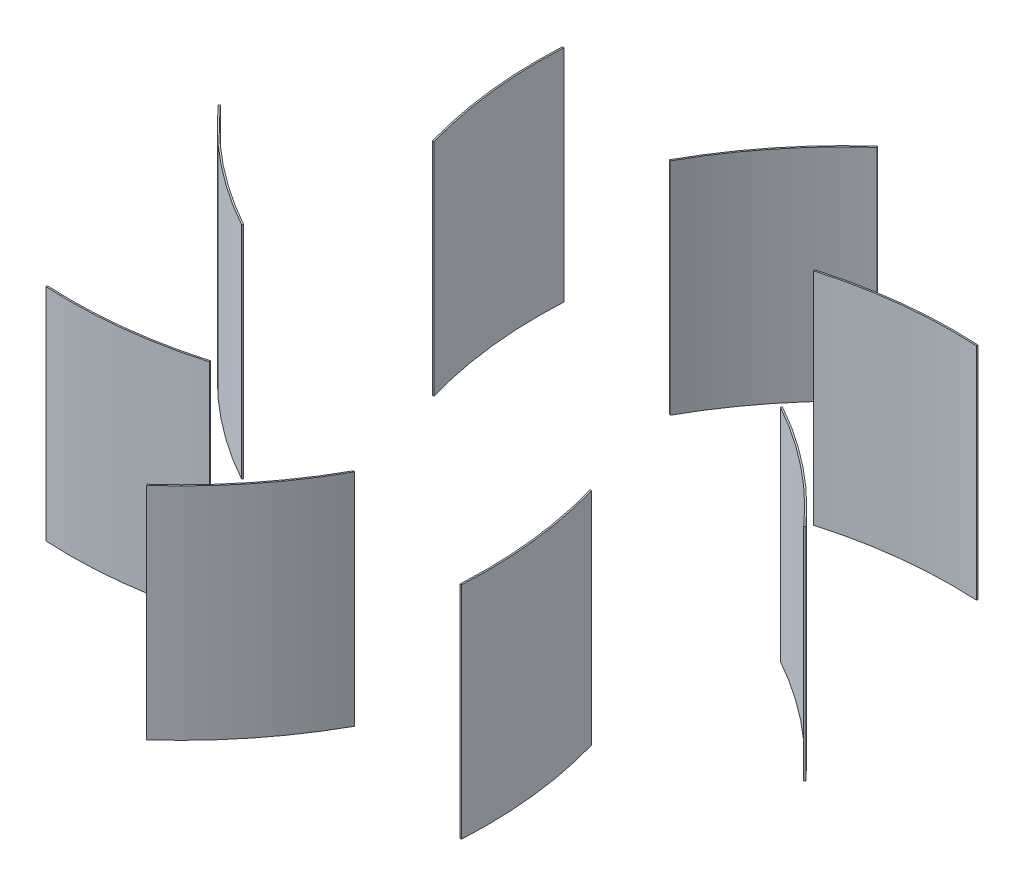
from build123d import *

# Parameters (mm, degrees)
EXTRUDE_THIN3_DEPTH   = 300
EXTRUDE_THIN3_2_DEPTH = 300
EXTRUDE_THIN3_3_DEPTH = 300
EXTRUDE_THIN3_4_DEPTH = 300
EXTRUDE_THIN3_5_DEPTH = 300
EXTRUDE_THIN3_6_DEPTH = 300
EXTRUDE_THIN3_7_DEPTH = 300
EXTRUDE_THIN3_8_DEPTH = 300


with BuildPart() as part:
    # Sketch1 → Extrude-Thin3 (new body)
    with BuildSketch(Plane(origin=(0, 1200, 0), x_dir=(1, 0, 0), z_dir=(0, 1, 0))):
        with BuildLine():
            ThreePointArc((50, 447.2135955), (-19.09284232, 374.101463889), (-75, 290.473750966))
            Line((-75, 290.473750966), (-76.75, 291.441996802))
            ThreePointArc((-76.75, 291.441996802), (-20.656485128, 375.348468769), (48.666666667, 448.704307485))
            Line((48.666666667, 448.704307485), (50, 447.2135955))
        make_face()
    extrude(amount=EXTRUDE_THIN3_DEPTH)


with BuildPart() as body_2:
    # Sketch1 → Extrude-Thin3 2 (new body)
    with BuildSketch(Plane(origin=(0, 1200, 0), x_dir=(1, 0, 0), z_dir=(0, 1, 0))):
        with BuildLine():
            ThreePointArc((351.583105076, 280.872426957), (251.029003691, 278.030360244), (152.362950476, 258.428967653))
            Line((152.362950476, 258.428967653), (151.810166805, 260.351057717))
            ThreePointArc((151.810166805, 260.351057717), (250.805106865, 280.017788284), (351.694388588, 282.869328552))
            Line((351.694388588, 282.869328552), (351.583105076, 280.872426957))
        make_face()
    extrude(amount=EXTRUDE_THIN3_2_DEPTH)


with BuildPart() as body_3:
    # Sketch1 → Extrude-Thin3 3 (new body)
    with BuildSketch(Plane(origin=(0, 1200, 0), x_dir=(1, 0, 0), z_dir=(0, 1, 0))):
        with BuildLine():
            ThreePointArc((447.2135955, -50), (374.101463889, 19.09284232), (290.473750966, 75))
            Line((290.473750966, 75), (291.441996802, 76.75))
            ThreePointArc((291.441996802, 76.75), (375.348468769, 20.656485128), (448.704307485, -48.666666667))
            Line((448.704307485, -48.666666667), (447.2135955, -50))
        make_face()
    extrude(amount=EXTRUDE_THIN3_3_DEPTH)


with BuildPart() as body_4:
    # Sketch1 → Extrude-Thin3 4 (new body)
    with BuildSketch(Plane(origin=(0, 1200, 0), x_dir=(1, 0, 0), z_dir=(0, 1, 0))):
        with BuildLine():
            ThreePointArc((280.872426958, -351.583105076), (278.030360245, -251.029003691), (258.428967653, -152.362950475))
            Line((258.428967653, -152.362950475), (260.351057717, -151.810166805))
            ThreePointArc((260.351057717, -151.810166805), (280.017788284, -250.805106865), (282.869328553, -351.694388588))
            Line((282.869328553, -351.694388588), (280.872426958, -351.583105076))
        make_face()
    extrude(amount=EXTRUDE_THIN3_4_DEPTH)


with BuildPart() as body_5:
    # Sketch1 → Extrude-Thin3 5 (new body)
    with BuildSketch(Plane(origin=(0, 1200, 0), x_dir=(1, 0, 0), z_dir=(0, 1, 0))):
        with BuildLine():
            ThreePointArc((-50, -447.2135955), (19.09284232, -374.101463889), (75, -290.473750966))
            Line((75, -290.473750966), (76.75, -291.441996802))
            ThreePointArc((76.75, -291.441996802), (20.656485128, -375.348468769), (-48.666666667, -448.704307485))
            Line((-48.666666667, -448.704307485), (-50, -447.2135955))
        make_face()
    extrude(amount=EXTRUDE_THIN3_5_DEPTH)


with BuildPart() as body_6:
    # Sketch1 → Extrude-Thin3 6 (new body)
    with BuildSketch(Plane(origin=(0, 1200, 0), x_dir=(1, 0, 0), z_dir=(0, 1, 0))):
        with BuildLine():
            ThreePointArc((-351.583105076, -280.872426958), (-251.029003691, -278.030360245), (-152.362950475, -258.428967653))
            Line((-152.362950475, -258.428967653), (-151.810166805, -260.351057717))
            ThreePointArc((-151.810166805, -260.351057717), (-250.805106865, -280.017788284), (-351.694388588, -282.869328552))
            Line((-351.694388588, -282.869328552), (-351.583105076, -280.872426958))
        make_face()
    extrude(amount=EXTRUDE_THIN3_6_DEPTH)


with BuildPart() as body_7:
    # Sketch1 → Extrude-Thin3 7 (new body)
    with BuildSketch(Plane(origin=(0, 1200, 0), x_dir=(1, 0, 0), z_dir=(0, 1, 0))):
        with BuildLine():
            ThreePointArc((-447.2135955, 50), (-374.101463889, -19.09284232), (-290.473750966, -75))
            Line((-290.473750966, -75), (-291.441996802, -76.75))
            ThreePointArc((-291.441996802, -76.75), (-375.348468769, -20.656485128), (-448.704307485, 48.666666667))
            Line((-448.704307485, 48.666666667), (-447.2135955, 50))
        make_face()
    extrude(amount=EXTRUDE_THIN3_7_DEPTH)


with BuildPart() as body_8:
    # Sketch1 → Extrude-Thin3 8 (new body)
    with BuildSketch(Plane(origin=(0, 1200, 0), x_dir=(1, 0, 0), z_dir=(0, 1, 0))):
        with BuildLine():
            ThreePointArc((-280.872426958, 351.583105076), (-278.030360245, 251.029003691), (-258.428967653, 152.362950475))
            Line((-258.428967653, 152.362950475), (-260.351057717, 151.810166805))
            ThreePointArc((-260.351057717, 151.810166805), (-280.017788284, 250.805106865), (-282.869328553, 351.694388588))
            Line((-282.869328553, 351.694388588), (-280.872426958, 351.583105076))
        make_face()
    extrude(amount=EXTRUDE_THIN3_8_DEPTH)


solid = Compound([part.part, body_2.part, body_3.part, body_4.part, body_5.part, body_6.part, body_7.part, body_8.part])
